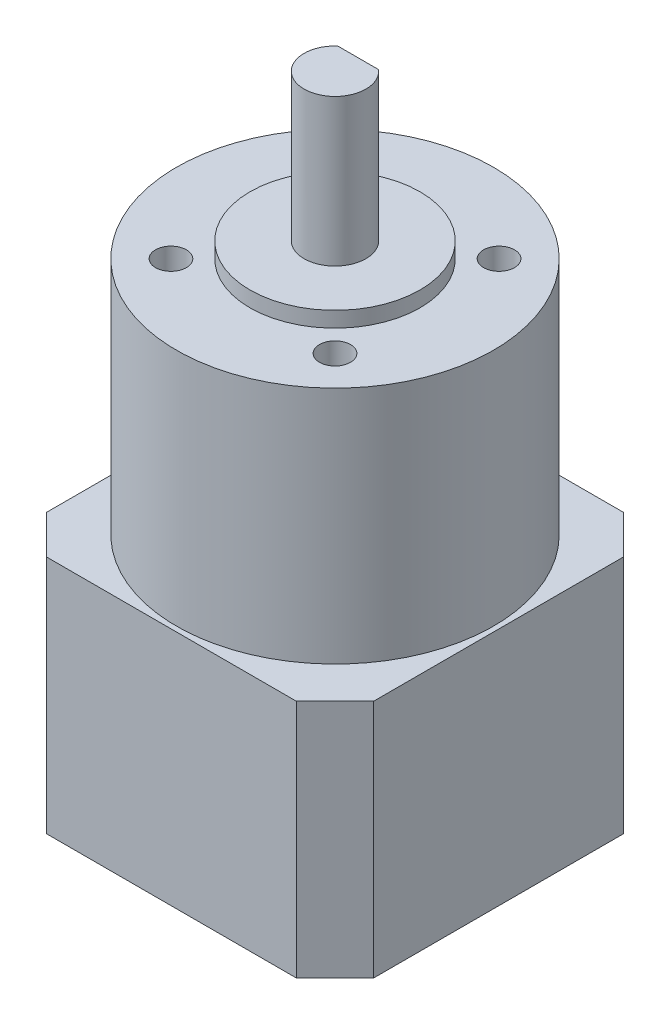
from build123d import *

# Parameters (mm, degrees)
SKETCH_1_W                = 42.3
SKETCH_1_H                = 42.3
EXTRUDE_1_DEPTH           = 31
SKETCH_2_R                = 20.5
EXTRUDE_2_DEPTH           = 30.9
SKETCH_3_R                = 11
EXTRUDE_3_DEPTH           = 2
SKETCH_4_R                = 4
EXTRUDE_4_DEPTH           = 19
CUT_EXTRUDE_START         = -13
CUT_EXTRUDE_1_DEPTH       = 13
HOLE_WIZARD_4_0_4_1_D     = 4
HOLE_WIZARD_4_0_4_1_DEPTH = 5
CHAMFER_1_SIZE            = 5


with BuildPart() as part:
    # 草图1 → 凸台-拉伸1 (new body)
    with BuildSketch(Plane.XZ.offset(61.9)):
        Rectangle(SKETCH_1_W, SKETCH_1_H)
    extrude(amount=-EXTRUDE_1_DEPTH)

    # 草图2 → 凸台-拉伸2 (add)
    with BuildSketch(Plane(origin=(0, -30.9, 0), x_dir=(-1, 0, 0), z_dir=(0, 1, 0))):
        with Locations(Location((0, 0, 0), (0, 0, 270))):
            Circle(SKETCH_2_R)
    extrude(amount=EXTRUDE_2_DEPTH)

    # 草图3 → 凸台-拉伸3 (add)
    with BuildSketch(Plane(origin=(0, 0, 0), x_dir=(-1, 0, 0), z_dir=(0, 1, 0))):
        with Locations(Location((0, 0, 0), (0, 0, 90))):
            Circle(SKETCH_3_R)
    extrude(amount=EXTRUDE_3_DEPTH)

    # 草图4 → 凸台-拉伸4 (add)
    with BuildSketch(Plane(origin=(0, 2, 0), x_dir=(-1, 0, 0), z_dir=(0, 1, 0))):
        with Locations(Location((0, 0, 0), (0, 0, 90))):
            Circle(SKETCH_4_R)
    extrude(amount=EXTRUDE_4_DEPTH)

    # 草图5 → 切除-拉伸1 (cut)
    with BuildSketch(Plane(origin=(0, 21, 0), x_dir=(-1, 0, 0), z_dir=(0, 1, 0)).offset(CUT_EXTRUDE_START)):
        with BuildLine():
            Line((2.645751311, -3), (-2.645751311, -3))
            ThreePointArc((-2.645751311, -3), (0, -4), (2.645751311, -3))
        make_face()
    extrude(amount=CUT_EXTRUDE_1_DEPTH, mode=Mode.SUBTRACT)

    # Ø4.0 (4) 直径孔1
    with Locations(Plane(origin=(0, 0, 0), x_dir=(1, 0, 0), z_dir=(0, 1, 0))):
        with Locations((-10.606601718, -10.606601718), (10.606601718, -10.606601718), (10.606601718, 10.606601718), (-10.606601718, 10.606601718)):
            Hole(HOLE_WIZARD_4_0_4_1_D / 2, depth=HOLE_WIZARD_4_0_4_1_DEPTH)

    # 倒角1
    chamfer_1_edges = [part.edges().sort_by_distance(p)[0] for p in [
        (-21.15, -46.4, -21.15),
        (-21.15, -46.4, 21.15),
        (21.15, -46.4, 21.15),
        (21.15, -46.4, -21.15),
    ]]
    chamfer(chamfer_1_edges, length=CHAMFER_1_SIZE)


solid = part.part
